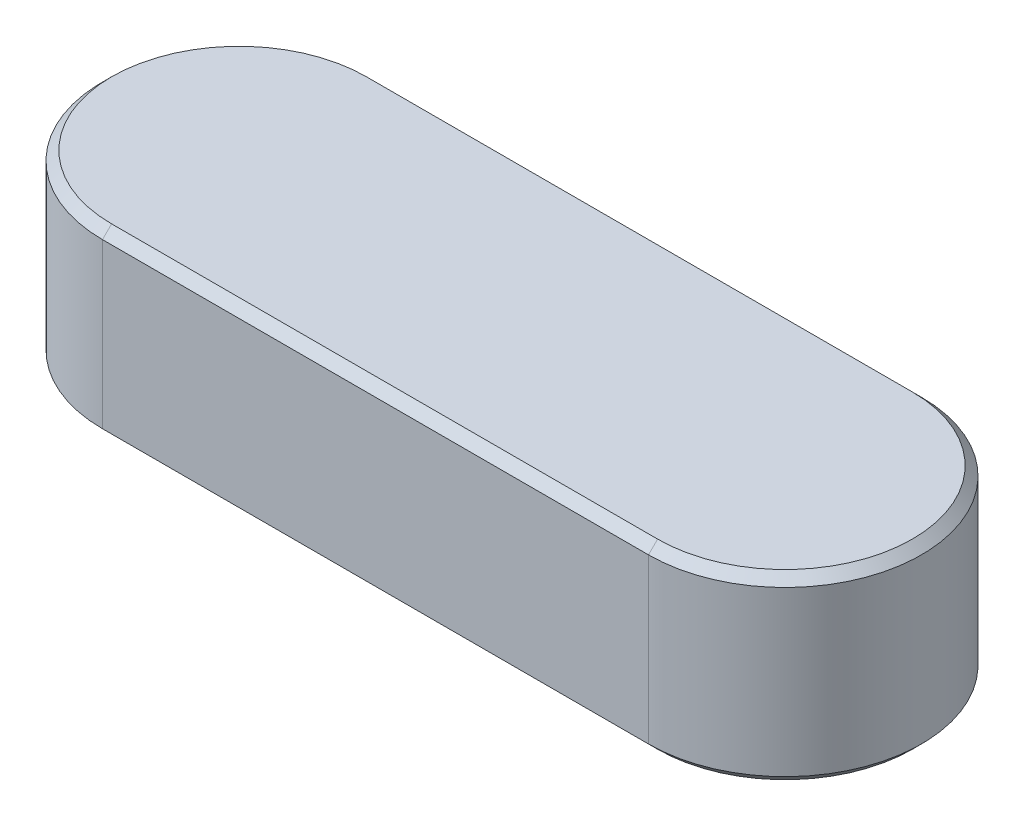
from build123d import *

# Parameters (mm, degrees)
EXTRUDE_1_DEPTH = 8
CHAMFER_1_SIZE  = 0.4
CHAMFER_2_SIZE  = 0.4


with BuildPart() as part:
    # 草图1 → 凸台-拉伸1 (new body)
    with BuildSketch(Plane(origin=(0, 0, 0), x_dir=(1, 0, 0), z_dir=(0, 1, 0))):
        with BuildLine():
            Line((-12, 6), (12, 6))
            ThreePointArc((12, 6), (18, 0), (12, -6))
            Line((12, -6), (-12, -6))
            ThreePointArc((-12, -6), (-18, 0), (-12, 6))
        make_face()
    extrude(amount=EXTRUDE_1_DEPTH)

    # 倒角1
    chamfer_1_edges = [part.edges().sort_by_distance(p)[0] for p in [
        (18, 8, 0),
        (0, 8, -6),
        (-18, 8, 0),
        (0, 8, 6),
    ]]
    chamfer(chamfer_1_edges, length=CHAMFER_1_SIZE)

    # 倒角2
    chamfer_2_edges = [part.edges().sort_by_distance(p)[0] for p in [
        (0, 0, -6),
        (18, 0, 0),
        (0, 0, 6),
        (-18, 0, 0),
    ]]
    chamfer(chamfer_2_edges, length=CHAMFER_2_SIZE)


solid = part.part
